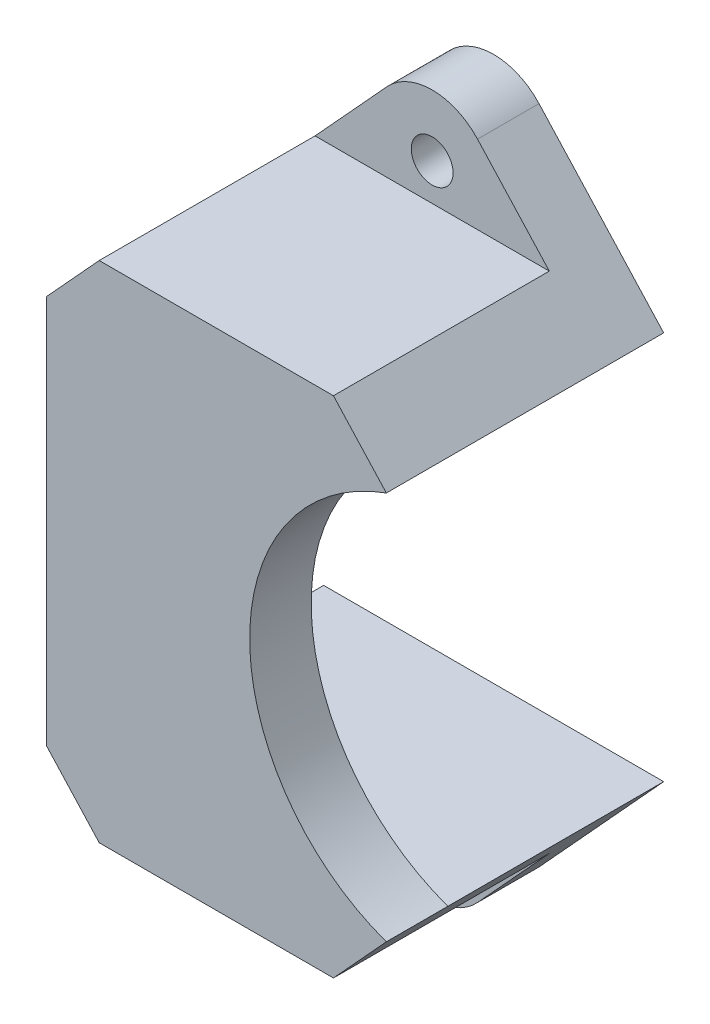
from build123d import *

# Parameters (mm, degrees)
SKETCH1_R             = 1.7
BOSS_EXTRUDE1_DEPTH   = 5
BOSS_EXTRUDE1_2_DEPTH = 5
BOSS_EXTRUDE2_DEPTH   = 12.55
BOSS_EXTRUDE3_DEPTH   = 5


with BuildPart() as part:
    # Sketch1 → Boss-Extrude1 (new body)
    with BuildSketch(Plane.XY):
        with BuildLine():
            Line((3.688712639, 26.875410947), (13.823430903, 15.8))
            Line((13.823430903, 15.8), (-13.823430903, 15.8))
            Line((-13.823430903, 15.8), (-3.688712639, 26.875410947))
            ThreePointArc((-3.688712639, 26.875410947), (0, 28.5), (3.688712639, 26.875410947))
        make_face()
        with Locations((0, 23.5)):
            Circle(SKETCH1_R, mode=Mode.SUBTRACT)
    extrude(amount=BOSS_EXTRUDE1_DEPTH)



with BuildPart() as body_2:
    # Sketch1 → Boss-Extrude1 2 (new body)
    with BuildSketch(Plane.XY):
        with BuildLine():
            ThreePointArc((3.688712639, -26.875410947), (0, -28.5), (-3.688712639, -26.875410947))
            Line((-3.688712639, -26.875410947), (-13.823430903, -15.8))
            Line((-13.823430903, -15.8), (13.823430903, -15.8))
            Line((13.823430903, -15.8), (3.688712639, -26.875410947))
        make_face()
        with Locations((0, -23.5)):
            Circle(SKETCH1_R, mode=Mode.SUBTRACT)
    extrude(amount=BOSS_EXTRUDE1_2_DEPTH)


with BuildPart() as part_1:
    add(part.part)

    add(body_2.part)  # Boss-Extrude2 merges body 2
    # Sketch2 → Boss-Extrude2 (add)
    with BuildSketch(Plane.XY.offset(5)):
        Polygon((-13.823430903, -15.8), (13.823430903, -15.8), (9.52262653, -20.5), (-9.52262653, -20.5), align=None)
        Polygon((-9.52262653, 20.5), (-13.823430903, 15.8), (13.823430903, 15.8), (9.52262653, 20.5), align=None)
    extrude(amount=BOSS_EXTRUDE2_DEPTH)

    # Sketch3 → Boss-Extrude3 (add)
    with BuildSketch(Plane.XY.offset(17.55)):
        with BuildLine():
            Line((-13.823430903, 15.8), (-13.823430903, -15.8))
            Line((-13.823430903, -15.8), (-9.52262653, -20.5))
            Line((-9.52262653, -20.5), (9.52262653, -20.5))
            Line((9.52262653, -20.5), (13.823430905, -15.8))
            ThreePointArc((13.823430905, -15.8), (2.711210982, -1e-09), (13.823430903, 15.8))
            Line((13.823430903, 15.8), (9.52262653, 20.5))
            Line((9.52262653, 20.5), (-9.52262653, 20.5))
            Line((-9.52262653, 20.5), (-13.823430903, 15.8))
        make_face()
    extrude(amount=BOSS_EXTRUDE3_DEPTH)


solid = part_1.part
